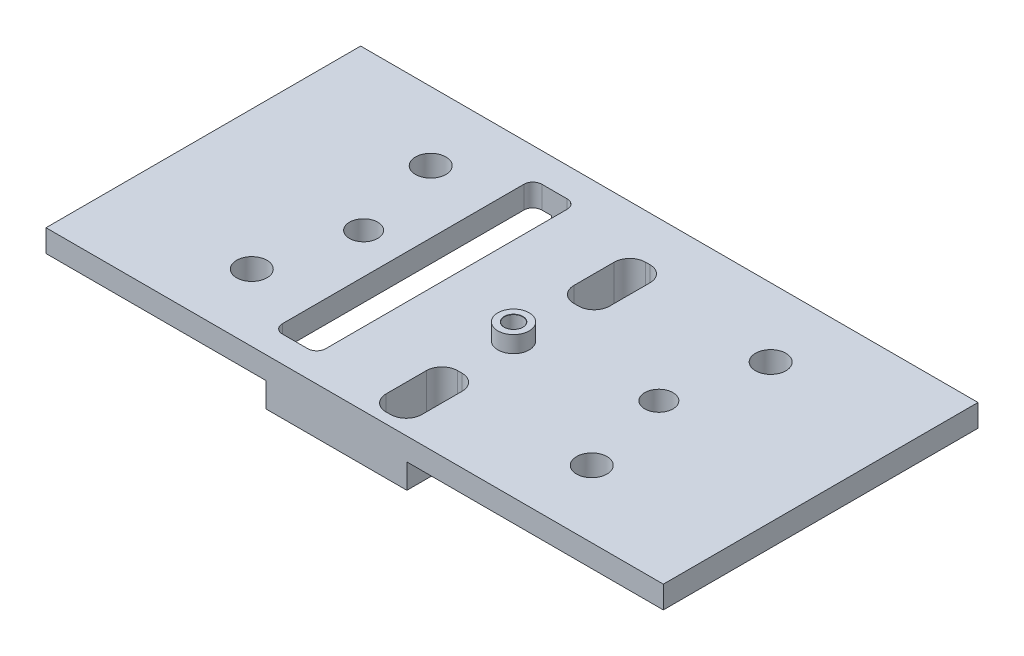
from build123d import *

# Parameters (mm, degrees)
SKETCH1_W                                = 60
SKETCH1_H                                = 35.17
BOSS_EXTRUDE1_DEPTH                      = 2.5
SKETCH2_W                                = 16.25
SKETCH2_H                                = 2.75
BOSS_EXTRUDE2_DEPTH                      = 35.17
CUT_EXTRUDE1_DEPTH                       = 70.745905973
CUT_EXTRUDE2_DEPTH                       = 70.745905973
SKETCH5_R                                = 1.75
BOSS_EXTRUDE3_DEPTH                      = 1.85
TAP_DRILL_FOR_M2_5X0_45_TAP1_D           = 2.05
TAP_DRILL_FOR_M2_5X0_45_TAP1_DEPTH       = 4
TAP_DRILL_FOR_M2_5X0_45_TAP1_CSINK_D     = 2.1
TAP_DRILL_FOR_M2_5X0_45_TAP1_CSINK_ANGLE = 90
TAP_DRILL_FOR_M2_5X0_45_TAP1_TIP         = 0.615882135
SKETCH14_R                               = 2.85
SKETCH14_R_2                             = 2.35
CUT_EXTRUDE4_DEPTH                       = 0.5
SKETCH15_W                               = 4.66
SKETCH15_H                               = 2.5
SKETCH15_W_2                             = 0.34
CUT_EXTRUDE5_DEPTH                       = 70.683939326
SKETCH9_R                                = 1.58
CUT_EXTRUDE3_DEPTH                       = 70.453632014
M3_CLEARANCE_HOLE1_D                     = 3.4
SKETCH17_W                               = 7
SKETCH17_H                               = 2.5
BOSS_EXTRUDE4_DEPTH                      = 35.17
SKETCH18_W                               = 0.25
SKETCH18_H                               = 2.75
CUT_EXTRUDE6_DEPTH                       = 76.494417012


with BuildPart() as part:
    # Sketch1 → Boss-Extrude1 (new body)
    with BuildSketch(Plane(origin=(0, 0, 0), x_dir=(1, 0, 0), z_dir=(0, 1, 0))):
        with Locations((30, 17.585)):
            Rectangle(SKETCH1_W, SKETCH1_H)
    extrude(amount=BOSS_EXTRUDE1_DEPTH)

    # Sketch2 → Boss-Extrude2 (add, through all)
    with BuildSketch(Plane.XY):
        with Locations((30.125, -1.375)):
            Rectangle(SKETCH2_W, SKETCH2_H)
    extrude(amount=-BOSS_EXTRUDE2_DEPTH)

    # Sketch3 → Cut-Extrude1 (cut, through all)
    with BuildSketch(Plane.XZ.offset(2.75)):
        with BuildLine():
            Line((21.16, -31.92), (24, -31.92))
            ThreePointArc((24, -31.92), (24.707106781, -31.627106781), (25, -30.92))
            Line((25, -30.92), (25, -3.92))
            ThreePointArc((25, -3.92), (24.707106781, -3.212893219), (24, -2.92))
            Line((24, -2.92), (21.16, -2.92))
            ThreePointArc((21.16, -2.92), (20.452893219, -3.212893219), (20.16, -3.92))
            Line((20.16, -3.92), (20.16, -30.92))
            ThreePointArc((20.16, -30.92), (20.452893219, -31.627106781), (21.16, -31.92))
        make_face()
    extrude(amount=-CUT_EXTRUDE1_DEPTH, mode=Mode.SUBTRACT)

    # Sketch4 → Cut-Extrude2 (cut, through all)
    with BuildSketch(Plane(origin=(0, 2.5, 0), x_dir=(1, 0, 0), z_dir=(0, 1, 0))):
        with BuildLine():
            Line((32.7475, 2.92), (32.7475, 7.42))
            ThreePointArc((32.7475, 7.42), (33.260063133, 8.657436867), (34.4975, 9.17))
            Line((34.4975, 9.17), (34.9975, 9.17))
            ThreePointArc((34.9975, 9.17), (36.234936867, 8.657436867), (36.7475, 7.42))
            Line((36.7475, 7.42), (36.7475, 2.92))
            ThreePointArc((36.7475, 2.92), (36.234936867, 1.682563133), (34.9975, 1.17))
            Line((34.9975, 1.17), (34.4975, 1.17))
            ThreePointArc((34.4975, 1.17), (33.260063133, 1.682563133), (32.7475, 2.92))
        make_face()
        with BuildLine():
            Line((32.7475, 28.42), (32.7475, 23.92))
            ThreePointArc((32.7475, 23.92), (33.260063133, 22.682563133), (34.4975, 22.17))
            Line((34.4975, 22.17), (34.9975, 22.17))
            ThreePointArc((34.9975, 22.17), (36.234936867, 22.682563133), (36.7475, 23.92))
            Line((36.7475, 23.92), (36.7475, 28.42))
            ThreePointArc((36.7475, 28.42), (36.234936867, 29.657436867), (34.9975, 30.17))
            Line((34.9975, 30.17), (34.4975, 30.17))
            ThreePointArc((34.4975, 30.17), (33.260063133, 29.657436867), (32.7475, 28.42))
        make_face()
    extrude(amount=-CUT_EXTRUDE2_DEPTH, mode=Mode.SUBTRACT)

    # Sketch5 → Boss-Extrude3 (add)
    with BuildSketch(Plane(origin=(0, 2.5, 0), x_dir=(1, 0, 0), z_dir=(0, 1, 0))):
        with Locations(Location((34.7475, 15.17, 0), (0, 0, 90))):
            Circle(SKETCH5_R)
    extrude(amount=BOSS_EXTRUDE3_DEPTH)

    # Tap Drill for M2.5x0.45 Tap1
    with Locations(Plane(origin=(0, 4.35, 0), x_dir=(1, 0, 0), z_dir=(0, 1, 0))):
        with Locations((34.7475, 15.17)):
            CounterSinkHole(TAP_DRILL_FOR_M2_5X0_45_TAP1_D / 2, TAP_DRILL_FOR_M2_5X0_45_TAP1_CSINK_D / 2, depth=TAP_DRILL_FOR_M2_5X0_45_TAP1_DEPTH, counter_sink_angle=TAP_DRILL_FOR_M2_5X0_45_TAP1_CSINK_ANGLE)
            with Locations((0, 0, -(TAP_DRILL_FOR_M2_5X0_45_TAP1_DEPTH + TAP_DRILL_FOR_M2_5X0_45_TAP1_TIP / 2))):  # 118° drill point
                Cone(0, TAP_DRILL_FOR_M2_5X0_45_TAP1_D / 2, TAP_DRILL_FOR_M2_5X0_45_TAP1_TIP, mode=Mode.SUBTRACT)

    # Sketch14 → Cut-Extrude4 (cut)
    with BuildSketch(Plane.XZ.offset(2.75)):
        with Locations((28.5, -25.31)):
            Circle(SKETCH14_R)
        with Locations((34.5, -18.31)):
            Circle(SKETCH14_R)
        with Locations((31, -11.31)):
            Circle(SKETCH14_R)
        with Locations((29, -4.31)):
            Circle(SKETCH14_R)
        with Locations((32.18, -32.31)):
            Circle(SKETCH14_R_2)
    extrude(amount=-CUT_EXTRUDE4_DEPTH, mode=Mode.SUBTRACT)

    # Sketch15 → Cut-Extrude5 (cut, through all)
    with BuildSketch(Plane(origin=(0, 0, -35.17), x_dir=(-1, 0, 0), z_dir=(0, 0, -1))):
        with Locations((-2.33, 1.25)):
            Rectangle(SKETCH15_W, SKETCH15_H)
        with Locations((-59.83, 1.25)):
            Rectangle(SKETCH15_W_2, SKETCH15_H)
    extrude(amount=-CUT_EXTRUDE5_DEPTH, mode=Mode.SUBTRACT)

    # Sketch9 → Cut-Extrude3 (cut, through all)
    with BuildSketch(Plane(origin=(0, 2.5, 0), x_dir=(1, 0, 0), z_dir=(0, 1, 0))):
        with Locations(Location((15.66, 17.5, 0), (0, 0, 270))):
            Circle(SKETCH9_R)
        with Locations(Location((48.66, 17.5, 0), (0, 0, 270))):
            Circle(SKETCH9_R)
    extrude(amount=-CUT_EXTRUDE3_DEPTH, mode=Mode.SUBTRACT)

    # M3 Clearance Hole1 (through all)
    with Locations(Plane(origin=(0, 2.5, 0), x_dir=(1, 0, 0), z_dir=(0, 1, 0))):
        with Locations((13.16, 7.5), (13.16, 27.5), (51.16, 27.5), (51.16, 7.5)):
            Hole(M3_CLEARANCE_HOLE1_D / 2)

    # Sketch17 → Boss-Extrude4 (add)
    with BuildSketch(Plane.XY):
        with Locations((63.16, 1.25)):
            Rectangle(SKETCH17_W, SKETCH17_H)
        with Locations((1.16, 1.25)):
            Rectangle(SKETCH17_W, SKETCH17_H)
    extrude(amount=-BOSS_EXTRUDE4_DEPTH)

    # Sketch18 → Cut-Extrude6 (cut, through all)
    with BuildSketch(Plane.XY):
        with Locations((38.125, -1.375)):
            Rectangle(SKETCH18_W, SKETCH18_H)
        with Locations((22.125, -1.375)):
            Rectangle(SKETCH18_W, SKETCH18_H)
    extrude(amount=-CUT_EXTRUDE6_DEPTH, mode=Mode.SUBTRACT)


solid = part.part
